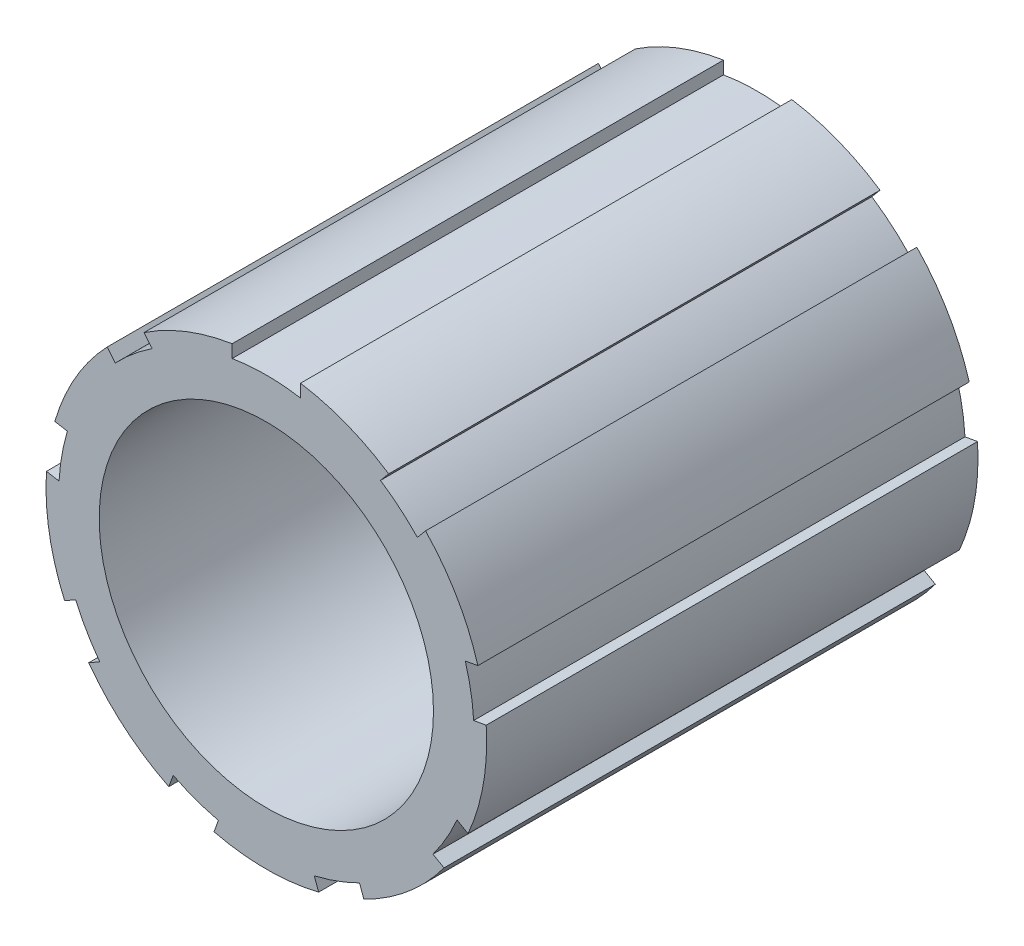
from build123d import *

# Parameters (mm, degrees)
SK_ESTRIADO_R = 13.2
EJE_DEPTH     = 38.8


with BuildPart() as part:
    # Sk_Estriado → Eje (new body)
    with BuildSketch(Plane.XY.offset(2.5)):
        with BuildLine():
            Line((2.7, 17.189240821), (2.7, 16.17621711))
            ThreePointArc((2.7, 16.17621711), (0, 16.4), (-2.7, 16.17621711))
            Line((-2.7, 16.17621711), (-2.7, 17.189240821))
            ThreePointArc((-2.7, 17.189240821), (-6.328756096, 16.208233904), (-9.662140027, 14.47076536))
            Line((-9.662140027, 14.47076536), (-9.01524753, 13.699828903))
            ThreePointArc((-9.01524753, 13.699828903), (-10.541716799, 12.563128867), (-11.926216414, 11.257235986))
            Line((-11.926216414, 11.257235986), (-12.573108911, 12.028172443))
            ThreePointArc((-12.573108911, 12.028172443), (-15.068842026, 8.7), (-16.703257352, 4.874545499))
            Line((-16.703257352, 4.874545499), (-15.712160547, 4.699788392))
            ThreePointArc((-15.712160547, 4.699788392), (-16.150847149, 2.847830114), (-16.372023623, 0.957518931))
            Line((-16.372023623, 0.957518931), (-17.363120427, 1.132276038))
            ThreePointArc((-17.363120427, 1.132276038), (-17.135654902, -3.021478291), (-15.928734927, -7.002528375))
            Line((-15.928734927, -7.002528375), (-15.057179023, -6.49933534))
            ThreePointArc((-15.057179023, -6.49933534), (-14.202816622, -8.2), (-13.157179023, -9.790231874))
            Line((-13.157179023, -9.790231874), (-14.028734927, -10.293424909))
            ThreePointArc((-14.028734927, -10.293424909), (-11.184504409, -13.32917331), (-7.700980401, -15.603041398))
            Line((-7.700980401, -15.603041398), (-7.356776093, -14.657347834))
            ThreePointArc((-7.356776093, -14.657347834), (-5.609130351, -15.410958981), (-3.785944134, -15.957024379))
            Line((-3.785944134, -15.957024379), (-4.130148442, -16.902717943))
            ThreePointArc((-4.130148442, -16.902717943), (0, -17.4), (4.130148442, -16.902717943))
            Line((4.130148442, -16.902717943), (3.785944134, -15.957024379))
            ThreePointArc((3.785944134, -15.957024379), (5.609130351, -15.410958981), (7.356776093, -14.657347834))
            Line((7.356776093, -14.657347834), (7.700980401, -15.603041398))
            ThreePointArc((7.700980401, -15.603041398), (11.184504409, -13.32917331), (14.028734927, -10.293424909))
            Line((14.028734927, -10.293424909), (13.157179023, -9.790231874))
            ThreePointArc((13.157179023, -9.790231874), (14.202816622, -8.2), (15.057179023, -6.49933534))
            Line((15.057179023, -6.49933534), (15.928734927, -7.002528375))
            ThreePointArc((15.928734927, -7.002528375), (17.135654902, -3.021478291), (17.363120427, 1.132276038))
            Line((17.363120427, 1.132276038), (16.372023623, 0.957518931))
            ThreePointArc((16.372023623, 0.957518931), (16.150847149, 2.847830114), (15.712160547, 4.699788392))
            Line((15.712160547, 4.699788392), (16.703257352, 4.874545499))
            ThreePointArc((16.703257352, 4.874545499), (15.068842026, 8.7), (12.573108911, 12.028172443))
            Line((12.573108911, 12.028172443), (11.926216414, 11.257235986))
            ThreePointArc((11.926216414, 11.257235986), (10.541716799, 12.563128867), (9.01524753, 13.699828903))
            Line((9.01524753, 13.699828903), (9.662140027, 14.47076536))
            ThreePointArc((9.662140027, 14.47076536), (6.328756096, 16.208233904), (2.7, 17.189240821))
        make_face()
        Circle(SK_ESTRIADO_R, mode=Mode.SUBTRACT)
    extrude(amount=-EJE_DEPTH)


solid = part.part
